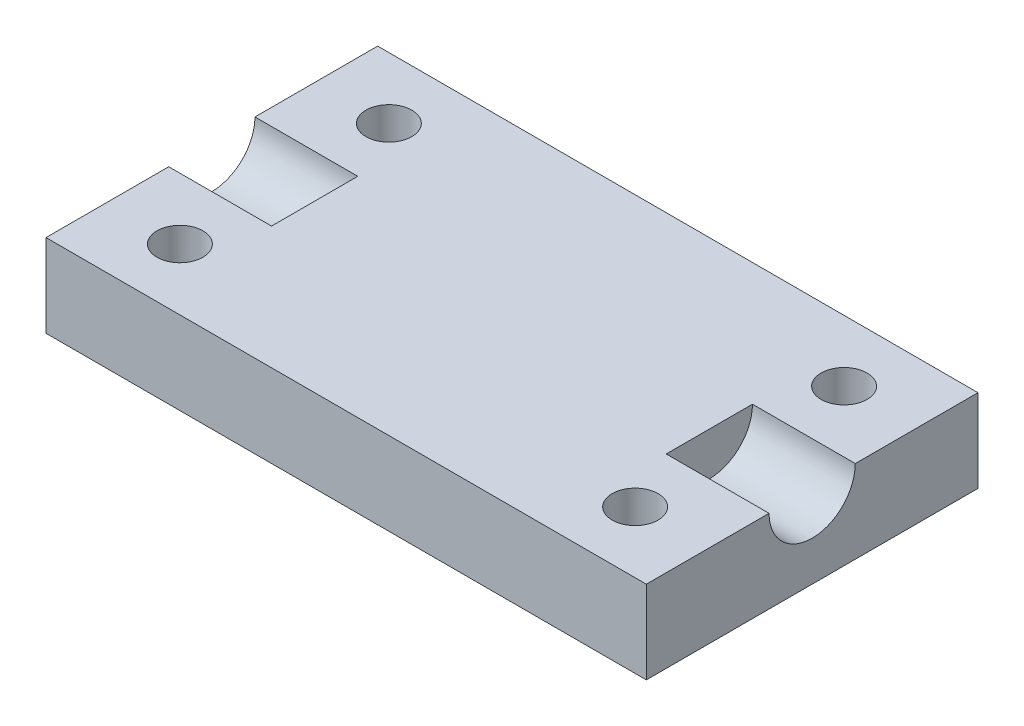
from build123d import *

# Parameters (mm, degrees)
SKETCH1_W           = 45.974
SKETCH1_H           = 25.4
BOSS_EXTRUDE1_DEPTH = 6.35
SKETCH2_R           = 3.302
CUT_EXTRUDE1_DEPTH  = 7.874
CUT_EXTRUDE2_START  = -7.874
SKETCH3_R           = 3.302
CUT_EXTRUDE2_DEPTH  = 7.874
CUT_EXTRUDE11_REACH = 29.019
SKETCH4_R           = 1.75895


with BuildPart() as part:
    # Sketch1 → Boss-Extrude1 (new body)
    with BuildSketch(Plane(origin=(0, 0, 0), x_dir=(1, 0, 0), z_dir=(0, 1, 0))):
        Rectangle(SKETCH1_W, SKETCH1_H)
    extrude(amount=-BOSS_EXTRUDE1_DEPTH)

    # Sketch2 → Cut-Extrude1 (cut)
    with BuildSketch(Plane(origin=(22.987, 0, 0), x_dir=(0, 0, -1), z_dir=(1, 0, 0))):
        Circle(SKETCH2_R)
    extrude(amount=-CUT_EXTRUDE1_DEPTH, mode=Mode.SUBTRACT)

    # Sketch3 → Cut-Extrude2 (cut)
    with BuildSketch(Plane.ZY.offset(22.987).offset(CUT_EXTRUDE2_START)):
        Circle(SKETCH3_R)
    extrude(amount=CUT_EXTRUDE2_DEPTH, mode=Mode.SUBTRACT)

    # Sketch4 → Cut-Extrude11 (cut, up to next)
    with BuildSketch(Plane(origin=(0, 0, 0), x_dir=(1, 0, 0), z_dir=(0, 1, 0)), mode=Mode.PRIVATE) as cut_extrude11_sk1:
        with Locations(Location((17.43075, -8.001, 0), (0, 0, 270))):
            Circle(SKETCH4_R)
    cut_extrude11_tool1 = extrude(cut_extrude11_sk1.sketch, amount=-CUT_EXTRUDE11_REACH, mode=Mode.PRIVATE) & part.part
    # Sketch4 → Cut-Extrude11 (cut, up to next)
    with BuildSketch(Plane(origin=(0, 0, 0), x_dir=(1, 0, 0), z_dir=(0, 1, 0)), mode=Mode.PRIVATE) as cut_extrude11_sk2:
        with Locations(Location((17.43075, 8.001, 0), (0, 0, 270))):
            Circle(SKETCH4_R)
    cut_extrude11_tool2 = extrude(cut_extrude11_sk2.sketch, amount=-CUT_EXTRUDE11_REACH, mode=Mode.PRIVATE) & part.part
    # Sketch4 → Cut-Extrude11 (cut, up to next)
    with BuildSketch(Plane(origin=(0, 0, 0), x_dir=(1, 0, 0), z_dir=(0, 1, 0)), mode=Mode.PRIVATE) as cut_extrude11_sk3:
        with Locations(Location((-17.43075, 8.001, 0), (0, 0, 270))):
            Circle(SKETCH4_R)
    cut_extrude11_tool3 = extrude(cut_extrude11_sk3.sketch, amount=-CUT_EXTRUDE11_REACH, mode=Mode.PRIVATE) & part.part
    # Sketch4 → Cut-Extrude11 (cut, up to next)
    with BuildSketch(Plane(origin=(0, 0, 0), x_dir=(1, 0, 0), z_dir=(0, 1, 0)), mode=Mode.PRIVATE) as cut_extrude11_sk4:
        with Locations(Location((-17.43075, -8.001, 0), (0, 0, 270))):
            Circle(SKETCH4_R)
    cut_extrude11_tool4 = extrude(cut_extrude11_sk4.sketch, amount=-CUT_EXTRUDE11_REACH, mode=Mode.PRIVATE) & part.part
    add(cut_extrude11_tool1.solids().sort_by_distance((17.43075, 0, 8.001))[0], mode=Mode.SUBTRACT)
    add(cut_extrude11_tool2.solids().sort_by_distance((17.43075, 0, -8.001))[0], mode=Mode.SUBTRACT)
    add(cut_extrude11_tool3.solids().sort_by_distance((-17.43075, 0, -8.001))[0], mode=Mode.SUBTRACT)
    add(cut_extrude11_tool4.solids().sort_by_distance((-17.43075, 0, 8.001))[0], mode=Mode.SUBTRACT)


solid = part.part
